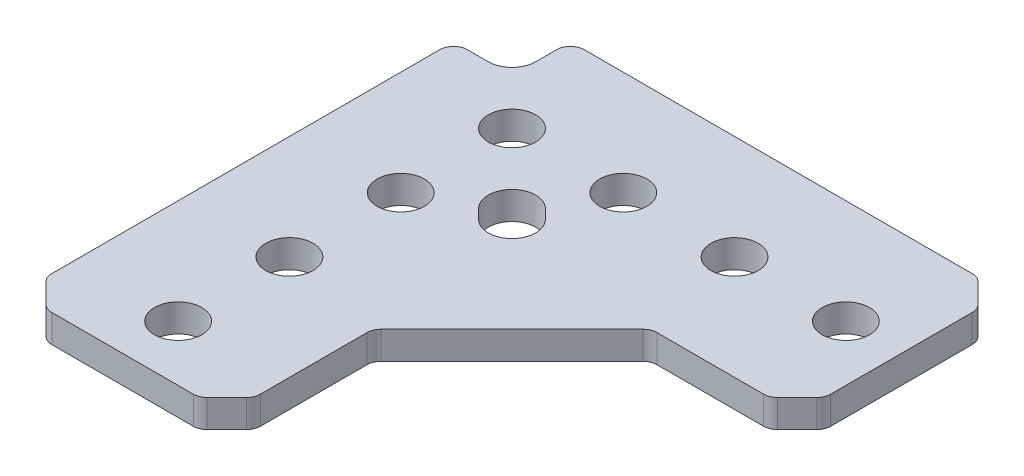
from build123d import *

# Parameters (mm, degrees)
SKETCH1_R           = 1.7
BOSS_EXTRUDE1_DEPTH = 2


with BuildPart() as part:
    # Sketch1 → Boss-Extrude1 (new body)
    with BuildSketch(Plane(origin=(0, 2, 0), x_dir=(1, 0, 0), z_dir=(0, 1, 0))):
        with BuildLine():
            Line((26.292893219, -7.207106781), (27.707106781, -5.792893219))
            ThreePointArc((27.707106781, -5.792893219), (27.923879533, -5.46846987), (28, -5.085786438))
            Line((28, -5.085786438), (28, 5.085786438))
            ThreePointArc((28, 5.085786438), (27.923879533, 5.46846987), (27.707106781, 5.792893219))
            Line((27.707106781, 5.792893219), (26.292893219, 7.207106781))
            ThreePointArc((26.292893219, 7.207106781), (25.96846987, 7.423879533), (25.585786438, 7.5))
            Line((25.585786438, 7.5), (-2.3, 7.5))
            ThreePointArc((-2.3, 7.5), (-3.007106781, 7.207106781), (-3.3, 6.5))
            Line((-3.3, 6.5), (-3.3, 5))
            ThreePointArc((-3.3, 5), (-3.797918472, 3.797918472), (-5, 3.3))
            Line((-5, 3.3), (-6.5, 3.3))
            ThreePointArc((-6.5, 3.3), (-7.207106781, 3.007106781), (-7.5, 2.3))
            Line((-7.5, 2.3), (-7.5, -25.585786438))
            ThreePointArc((-7.5, -25.585786438), (-7.423879533, -25.96846987), (-7.207106781, -26.292893219))
            Line((-7.207106781, -26.292893219), (-5.792893219, -27.707106781))
            ThreePointArc((-5.792893219, -27.707106781), (-5.46846987, -27.923879533), (-5.085786438, -28))
            Line((-5.085786438, -28), (5.085786438, -28))
            ThreePointArc((5.085786438, -28), (5.46846987, -27.923879533), (5.792893219, -27.707106781))
            Line((5.792893219, -27.707106781), (7.207106781, -26.292893219))
            ThreePointArc((7.207106781, -26.292893219), (7.423879533, -25.96846987), (7.5, -25.585786438))
            Line((7.5, -25.585786438), (7.5, -17.914213562))
            ThreePointArc((7.5, -17.914213562), (7.576120467, -17.53153013), (7.792893219, -17.207106781))
            Line((7.792893219, -17.207106781), (17.207106781, -7.792893219))
            ThreePointArc((17.207106781, -7.792893219), (17.53153013, -7.576120467), (17.914213562, -7.5))
            Line((17.914213562, -7.5), (25.585786438, -7.5))
            ThreePointArc((25.585786438, -7.5), (25.96846987, -7.423879533), (26.292893219, -7.207106781))
        make_face()
        with Locations(Location((0, -16, 0), (0, 0, 90))):
            Circle(SKETCH1_R, mode=Mode.SUBTRACT)
        with Locations(Location((0, -24, 0), (0, 0, 90))):
            Circle(SKETCH1_R, mode=Mode.SUBTRACT)
        with Locations(Location((24, 0, 0), (0, 0, 90))):
            Circle(SKETCH1_R, mode=Mode.SUBTRACT)
        with Locations(Location((16, 0, 0), (0, 0, 90))):
            Circle(SKETCH1_R, mode=Mode.SUBTRACT)
        with Locations(Location((0, 0, 0), (0, 0, 90))):
            Circle(SKETCH1_R, mode=Mode.SUBTRACT)
        with Locations(Location((8, 0, 0), (0, 0, 90))):
            Circle(SKETCH1_R, mode=Mode.SUBTRACT)
        with Locations(Location((0, -8, 0), (0, 0, 90))):
            Circle(SKETCH1_R, mode=Mode.SUBTRACT)
        with BuildLine():
            Line((4.454772721, -6.858935778), (3.797918472, -6.202081528))
            ThreePointArc((3.797918472, -6.202081528), (3.797918472, -3.797918472), (6.202081528, -3.797918472))
            Line((6.202081528, -3.797918472), (6.858935778, -4.454772721))
            ThreePointArc((6.858935778, -4.454772721), (6.858935778, -6.858935778), (4.454772721, -6.858935778))
        make_face(mode=Mode.SUBTRACT)
    extrude(amount=-BOSS_EXTRUDE1_DEPTH)


solid = part.part
